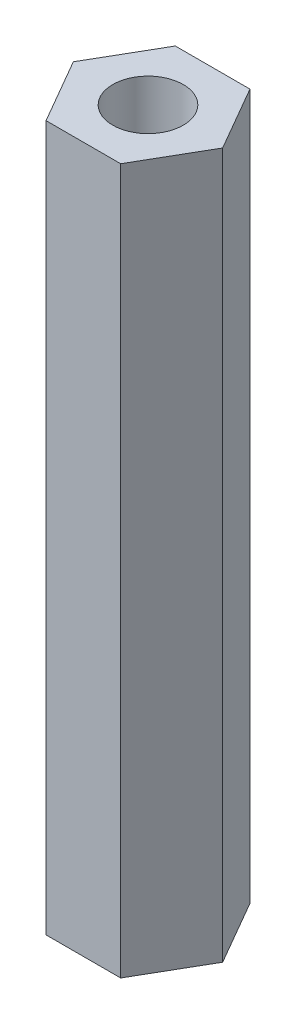
from build123d import *

# Parameters (mm, degrees)
BOSS_EXTRUDE1_DEPTH = 30
SKETCH2_R           = 1.5
CUT_EXTRUDE1_DEPTH  = 10


with BuildPart() as part:
    # Sketch1 → Boss-Extrude1 (new body)
    with BuildSketch(Plane(origin=(0, 0, 0), x_dir=(1, 0, 0), z_dir=(0, 1, 0))):
        Polygon((3.175426481, 0), (1.58771324, 2.75), (-1.58771324, 2.75), (-3.175426481, 0), (-1.58771324, -2.75), (1.58771324, -2.75), align=None)
    extrude(amount=BOSS_EXTRUDE1_DEPTH)

    # Sketch2 → Cut-Extrude1 (cut)
    with BuildSketch(Plane(origin=(0, 30, 0), x_dir=(1, 0, 0), z_dir=(0, 1, 0))):
        with Locations(Location((0, 0, 0), (0, 0, 270))):
            Circle(SKETCH2_R)
    cut_extrude1 = extrude(amount=-CUT_EXTRUDE1_DEPTH, mode=Mode.SUBTRACT)

    # Mirror1: Cut-Extrude1 across plane
    add(cut_extrude1.mirror(Plane(origin=(0, 15, 0), x_dir=(0, 0, 1), z_dir=(0, -1, 0))), mode=Mode.SUBTRACT)


solid = part.part
